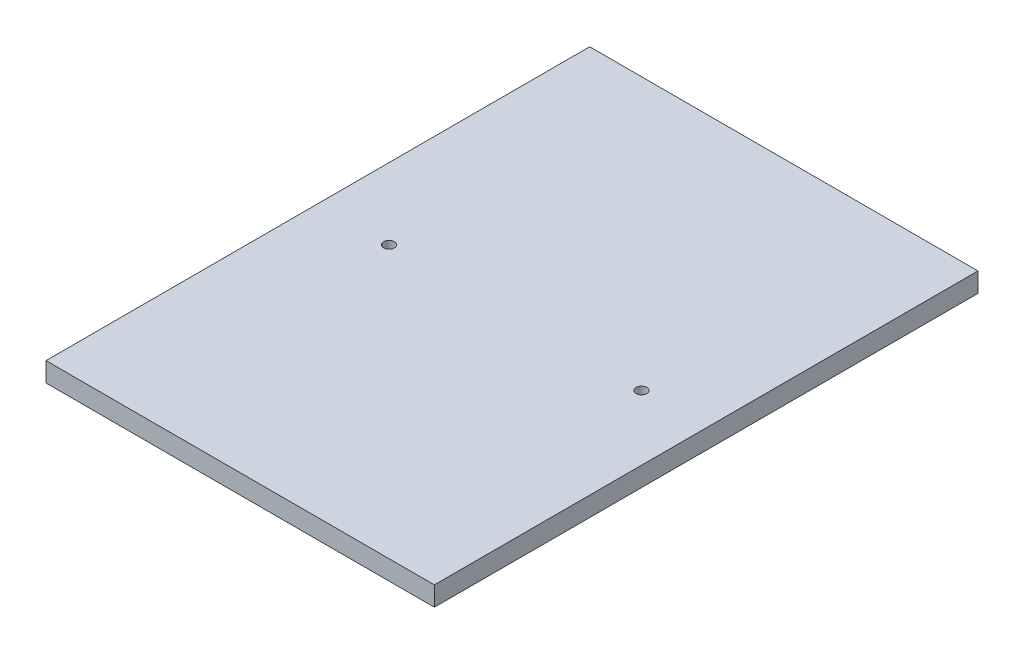
from build123d import *

# Parameters (mm, degrees)
SKETCH1_W           = 180
SKETCH1_H           = 252
BOSS_EXTRUDE1_DEPTH = 4.5
SKETCH2_R           = 2.5
CUT_EXTRUDE1_DEPTH  = 156.103191457


with BuildPart() as part:
    # Sketch1 → Boss-Extrude1 (new, symmetric)
    with BuildSketch(Plane(origin=(0, 0, 0), x_dir=(1, 0, 0), z_dir=(0, 1, 0))):
        Rectangle(SKETCH1_W, SKETCH1_H)
    extrude(amount=BOSS_EXTRUDE1_DEPTH, both=True)

    # Sketch2 → Cut-Extrude1 (cut, through all)
    with BuildSketch(Plane(origin=(0, 4.5, 0), x_dir=(1, 0, 0), z_dir=(0, 1, 0))):
        with Locations(Location((60, 0, 0), (0, 0, 270))):
            Circle(SKETCH2_R)
        with Locations(Location((-57, 0, 0), (0, 0, 270))):
            Circle(SKETCH2_R)
    extrude(amount=-CUT_EXTRUDE1_DEPTH, mode=Mode.SUBTRACT)


solid = part.part
